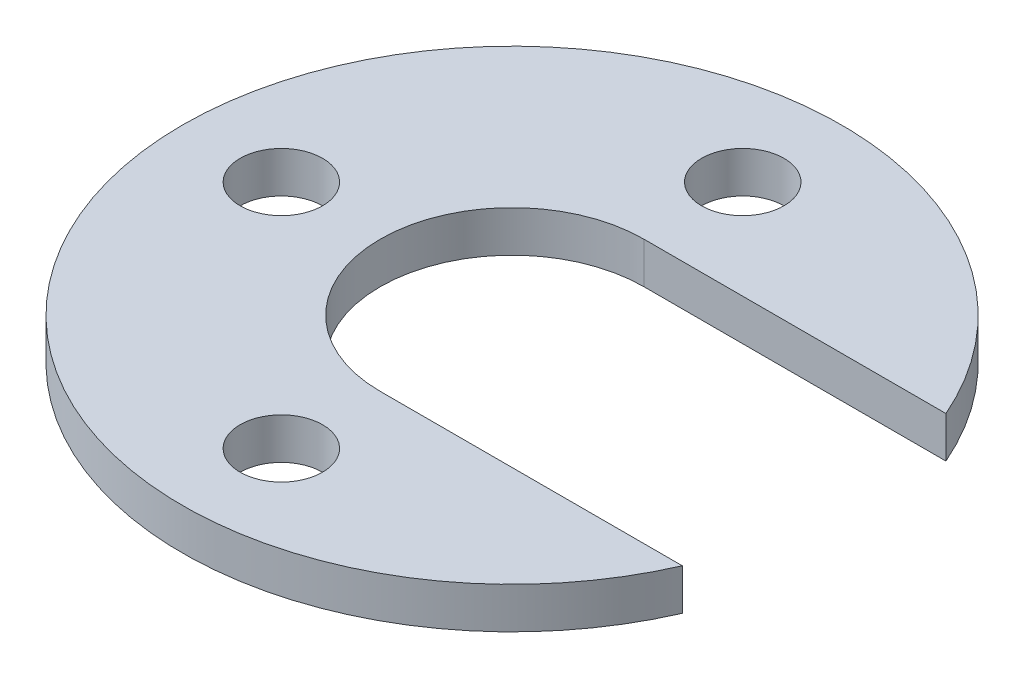
from build123d import *

# Parameters (mm, degrees)
SKETCH1_R           = 5
BOSS_EXTRUDE1_DEPTH = 5


with BuildPart() as part:
    # Sketch1 → Boss-Extrude1 (new body)
    with BuildSketch(Plane(origin=(0, 0, 0), x_dir=(1, 0, 0), z_dir=(0, 1, 0))):
        with BuildLine():
            Line((0, 16), (36.66060556, 16))
            ThreePointArc((36.66060556, 16), (-40, 0), (36.66060556, -16))
            Line((36.66060556, -16), (0, -16))
            ThreePointArc((0, -16), (-16, 0), (0, 16))
        make_face()
        with Locations(Location((0, 28, 0), (0, 0, 270))):
            Circle(SKETCH1_R, mode=Mode.SUBTRACT)
        with Locations(Location((-28, 0, 0), (0, 0, 90))):
            Circle(SKETCH1_R, mode=Mode.SUBTRACT)
        with Locations(Location((0, -28, 0), (0, 0, 90))):
            Circle(SKETCH1_R, mode=Mode.SUBTRACT)
    extrude(amount=BOSS_EXTRUDE1_DEPTH)


solid = part.part
